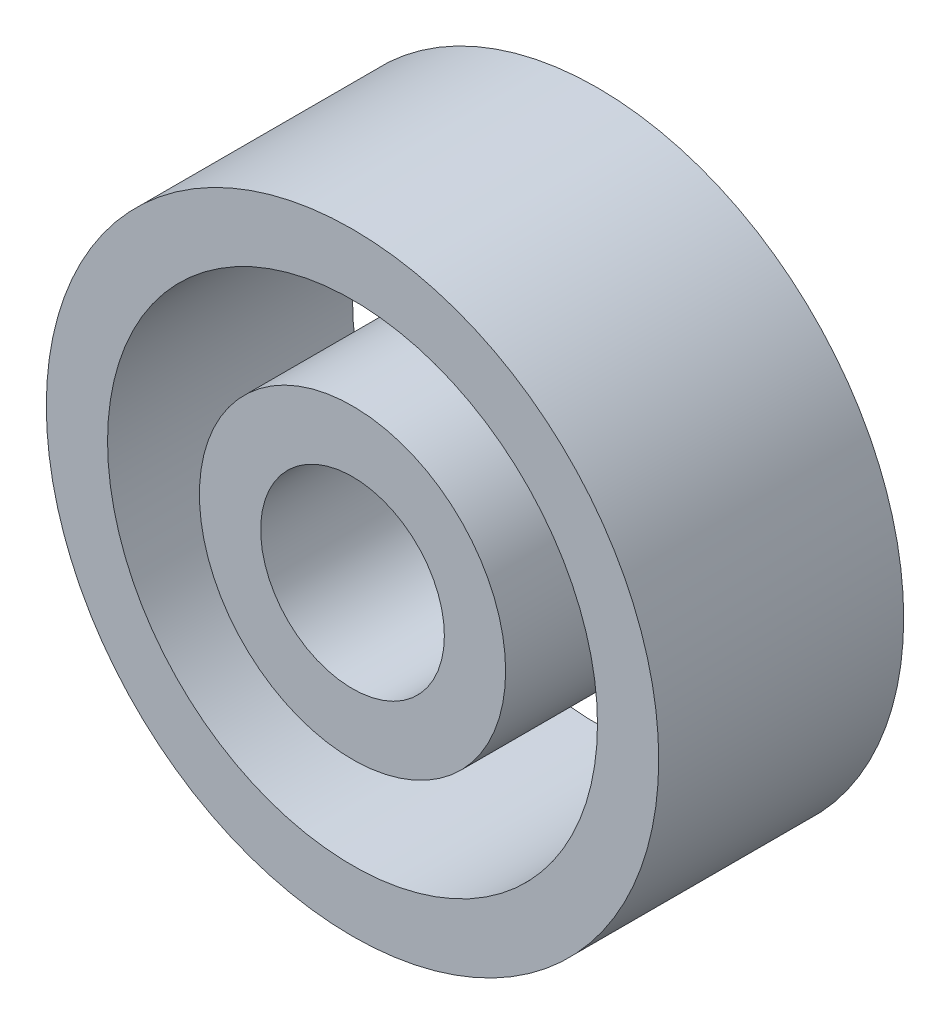
from build123d import *

# Parameters (mm, degrees)
SKETCH_1_R      = 5
SKETCH_1_R_2    = 4
EXTRUDE_1_DEPTH = 2
SKETCH_2_R      = 2.5
SKETCH_2_R_2    = 1.5
EXTRUDE_2_DEPTH = 2


with BuildPart() as part:
    # 草图1 → 凸台-拉伸1 (new, symmetric)
    with BuildSketch(Plane.XY):
        Circle(SKETCH_1_R)
        Circle(SKETCH_1_R_2, mode=Mode.SUBTRACT)
    extrude(amount=EXTRUDE_1_DEPTH, both=True)


with BuildPart() as body_2:
    # 草图2 → 凸台-拉伸2 (new, symmetric)
    with BuildSketch(Plane.XY):
        Circle(SKETCH_2_R)
        Circle(SKETCH_2_R_2, mode=Mode.SUBTRACT)
    extrude(amount=EXTRUDE_2_DEPTH, both=True)


solid = Compound([part.part, body_2.part])
